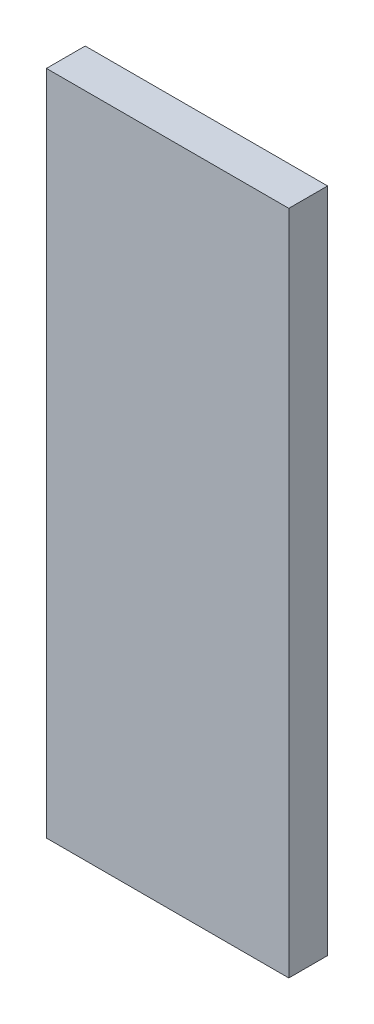
from build123d import *

# Parameters (mm, degrees)
SKETCH1_W           = 500
SKETCH1_H           = 1375
BOSS_EXTRUDE1_DEPTH = 80


with BuildPart() as part:
    # Sketch1 → Boss-Extrude1 (new body)
    with BuildSketch(Plane.XY):
        with Locations((0, 687.5)):
            Rectangle(SKETCH1_W, SKETCH1_H)
    extrude(amount=-BOSS_EXTRUDE1_DEPTH)


solid = part.part
